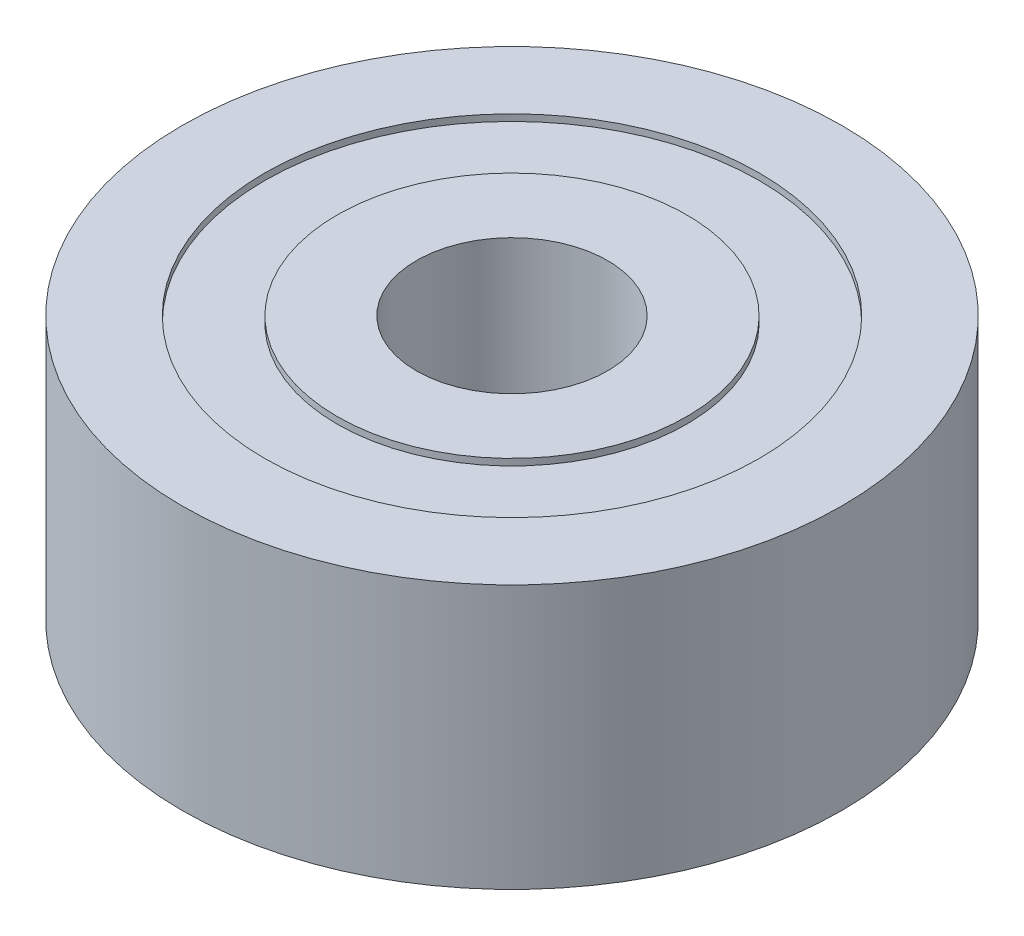
from build123d import *

# Parameters (mm, degrees)
SKETCH_1_R          = 5
SKETCH_1_R_2        = 1.45
EXTRUDE_1_DEPTH     = 2
SKETCH_2_R          = 3.75
SKETCH_2_R_2        = 2.65
CUT_EXTRUDE_1_DEPTH = 0.1


with BuildPart() as part:
    # Эскиз1 → Бобышка-Вытянуть1 (new, symmetric)
    with BuildSketch(Plane(origin=(0, 0, 0), x_dir=(1, 0, 0), z_dir=(0, 1, 0))):
        with Locations(Location((0, 0, 0), (0, 0, 270))):
            Circle(SKETCH_1_R)
        with Locations(Location((0, 0, 0), (0, 0, 270))):
            Circle(SKETCH_1_R_2, mode=Mode.SUBTRACT)
    extrude(amount=EXTRUDE_1_DEPTH, both=True)

    # Эскиз2 → Вырез-Вытянуть1 (cut)
    with BuildSketch(Plane(origin=(0, 2, 0), x_dir=(1, 0, 0), z_dir=(0, 1, 0))):
        with Locations(Location((0, 0, 0), (0, 0, 270))):
            Circle(SKETCH_2_R)
        with Locations(Location((0, 0, 0), (0, 0, 270))):
            Circle(SKETCH_2_R_2, mode=Mode.SUBTRACT)
    cut_extrude_1 = extrude(amount=-CUT_EXTRUDE_1_DEPTH, mode=Mode.SUBTRACT)

    # Зеркальное отражение1: Вырез-Вытянуть1 across plane
    add(cut_extrude_1.mirror(Plane.ZX), mode=Mode.SUBTRACT)


solid = part.part
